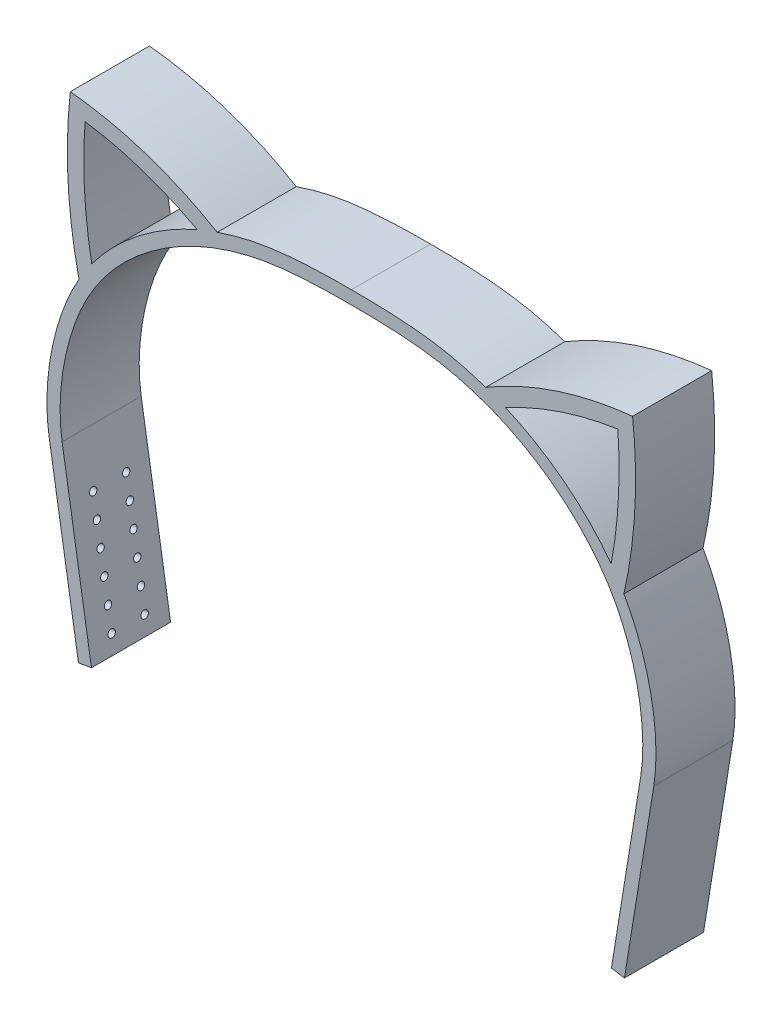
from build123d import *

# Parameters (mm, degrees)
EXTRUDE_1_DEPTH = 24
F_2_0MM_1_D     = 2.2
F_2_0MM_1_DEPTH = 2
F_2_0MM_1_TIP   = 0.660946681


with BuildPart() as part:
    # 草图1 → 凸台-拉伸1 (new body)
    with BuildSketch(Plane.XY):
        with BuildLine():
            add(Edge.make_bspline(
                [(-85.303811148, 105.898414939), (-88.009109302, 81.683287632), (-82.672363695, 57.926613297)],
                knots=[0, 0, 0, 1, 1, 1], degree=2))
            add(Edge.make_bspline(
                [(-82.672363695, 57.926613297), (-81.478722874, 60.008111355), (-80.178814673, 61.9908522), (-78.796368827, 63.875498361)],
                knots=[0.265222822, 0.265222822, 0.265222822, 0.265222822, 0.304620703, 0.304620703, 0.304620703, 0.304620703], degree=3))
            add(Edge.make_bspline(
                [(-78.796368831, 63.875498364), (-78.910809837, 64.482582045), (-81.110864738, 76.740394775), (-81.25829733, 94.377839227), (-80.80897441, 100.291183249)],
                knots=[0.213670599, 0.213670599, 0.213670599, 0.240071279, 0.746690426, 1, 1, 1], degree=2))
            add(Edge.make_bspline(
                [(-80.80897441, 100.291183249), (-74.954242367, 99.411126281), (-58.067018564, 94.891856442), (-47.206375635, 89.127530631), (-46.769380644, 88.890315757)],
                knots=[0.110321694, 0.110321694, 0.110321694, 0.37043822, 0.890671272, 0.912537017, 0.912537017, 0.912537017], degree=2))
            add(Edge.make_bspline(
                [(-46.769380641, 88.890315749), (-44.71433423, 89.777898648), (-42.703123712, 90.548546165), (-40.749633794, 91.223596451)],
                knots=[0.567242148, 0.567242148, 0.567242148, 0.567242148, 0.618773343, 0.618773343, 0.618773343, 0.618773343], degree=3))
            add(Edge.make_bspline(
                [(-85.303811148, 105.898414939), (-61.38245558, 103.431937236), (-40.749633794, 91.223596451)],
                knots=[0, 0, 0, 1, 1, 1], degree=2))
        make_face()
        with BuildLine():
            Line((-87.798138535, 12.622668998), (-78.887788168, -42.304366094))
            Line((-78.887788168, -42.304366094), (-82.836173004, -42.944879316))
            Line((-82.836173004, -42.944879316), (-91.746523371, 11.982155776))
            add(Edge.make_bspline(
                [(-91.746523371, 11.982155776), (-93.927434534, 25.426181997), (-88.406602225, 57.128648527), (-60.748492356, 83.186289469), (-36.399912338, 93.633682679), (-19.022398101, 96.170250702), (-5.974564228, 96.506050334), (0, 96.506050334)],
                knots=[0, 0, 0, 0, 0.265222822, 0.454793677, 0.63911527, 0.85378597, 1, 1, 1, 1], degree=3))
            Line((0, 96.506050334), (0, 92.506050334))
            add(Edge.make_bspline(
                [(-87.798138535, 12.622668998), (-87.917998492, 13.361534674), (-88.115574705, 14.82228619), (-88.386383604, 17.948353716), (-88.465992349, 22.069730122), (-88.148916082, 27.289265538), (-87.175946563, 34.457045729), (-84.936811189, 43.552038848), (-80.70099625, 53.872547274), (-74.981688561, 62.779256808), (-68.067383531, 70.377057927), (-60.531768082, 76.633774135), (-52.977902003, 81.505072411), (-45.671368613, 85.146344571), (-38.683899128, 87.801878194), (-32.206525702, 89.683190694), (-26.133550852, 90.937554568), (-20.134365858, 91.724983846), (-14.956465354, 92.117805958), (-10.619444347, 92.327717748), (-7.247175397, 92.433691174), (-4.31061117, 92.483746465), (-1.883104331, 92.50297345), (-0.623917284, 92.506050334), (0, 92.506050334)],
                knots=[0, 0, 0, 0, 0.015625, 0.03125, 0.0625, 0.09375, 0.125, 0.1875, 0.25, 0.3125, 0.375, 0.4375, 0.5, 0.5625, 0.625, 0.6875, 0.75, 0.8125, 0.875, 0.90625, 0.9375, 0.96875, 0.984375, 1, 1, 1, 1], degree=3))
        make_face()
    extrude(amount=EXTRUDE_1_DEPTH)

    # Ø2.0mm 暗销孔1
    with Locations(Plane(origin=(-83.551735086, -13.553894401, 0), x_dir=(0, 0, -1), z_dir=(0.9870962089406052, 0.16012830572726736, 0))):
        with Locations((-7.030788703, 4.095368433), (-7.030788703, 11.095368433), (-17.027725635, 11.095368433), (-17.027725635, 4.095368433), (-17.027725635, -2.904631567), (-17.027725635, -9.904631567), (-17.027725635, -16.904631567), (-17.027725635, -23.904631567), (-7.030788703, -23.904631567), (-7.030788703, -16.904631567), (-7.030788703, -9.904631567), (-7.030788703, -2.904631567)):
            Hole(F_2_0MM_1_D / 2, depth=F_2_0MM_1_DEPTH)
            with Locations((0, 0, -(F_2_0MM_1_DEPTH + F_2_0MM_1_TIP / 2))):  # 118° drill point
                Cone(0, F_2_0MM_1_D / 2, F_2_0MM_1_TIP, mode=Mode.SUBTRACT)

    # 镜向1: part across plane


with BuildPart() as part_1:
    add(part.part)
    add(part.part.mirror(Plane(origin=(0, 0, 24), x_dir=(0, 0, 1), z_dir=(1, 0, 0))))


solid = part_1.part
